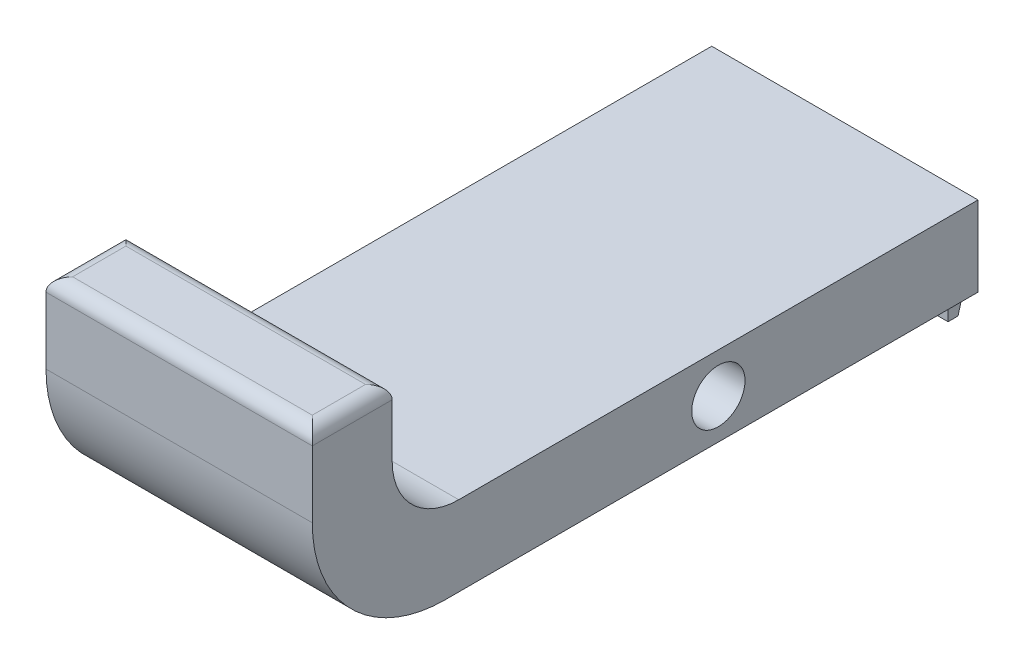
from build123d import *

# Parameters (mm, degrees)
SKETCH2_W                = 20
SKETCH2_H                = 6
BOSS_EXTRUDE1_DEPTH      = 50
BOSS_EXTRUDE3_DEPTH      = 9
BOSS_EXTRUDE3_DEPTH_BACK = 9
SKETCH6_R                = 2
CUT_EXTRUDE1_DEPTH       = 20
SKETCH7_W                = 20
SKETCH7_H                = 6
BOSS_EXTRUDE4_DEPTH      = 10
FILLET1_R                = 10
FILLET2_R                = 5
FILLET3_R                = 1


with BuildPart() as part:
    # Sketch2 → Boss-Extrude1 (new body)
    with BuildSketch(Plane.XY):
        Rectangle(SKETCH2_W, SKETCH2_H)
    extrude(amount=BOSS_EXTRUDE1_DEPTH)

    # Sketch5 → Boss-Extrude3 (add, two sides: drawn at the far end of the back side and taken through both)
    with BuildSketch(Plane(origin=(0, 0, 0), x_dir=(0, 0, -1), z_dir=(1, 0, 0)).offset(-BOSS_EXTRUDE3_DEPTH_BACK)):
        Polygon((0, -3), (-0.5, -4.8), (-1.25, -4.8), (-1.25, -3), align=None)
    extrude(amount=BOSS_EXTRUDE3_DEPTH + BOSS_EXTRUDE3_DEPTH_BACK)

    # Sketch6 → Cut-Extrude1 (cut)
    with BuildSketch(Plane(origin=(10, 0, 0), x_dir=(0, 0, -1), z_dir=(1, 0, 0))):
        with Locations((-19.5, 0)):
            Circle(SKETCH6_R)
    extrude(amount=-CUT_EXTRUDE1_DEPTH, mode=Mode.SUBTRACT)

    # Sketch7 → Boss-Extrude4 (add)
    with BuildSketch(Plane(origin=(0, 3, 0), x_dir=(1, 0, 0), z_dir=(0, 1, 0))):
        with Locations((0, -47)):
            Rectangle(SKETCH7_W, SKETCH7_H)
    extrude(amount=BOSS_EXTRUDE4_DEPTH)

    # Fillet1
    fillet1_edges = [part.edges().sort_by_distance(p)[0] for p in [
        (0, -3, 50),
    ]]
    fillet(fillet1_edges, radius=FILLET1_R)

    # Fillet2
    fillet2_edges = [part.edges().sort_by_distance(p)[0] for p in [
        (0, 3, 44),
    ]]
    fillet(fillet2_edges, radius=FILLET2_R)

    # Fillet3
    fillet3_edges = [part.edges().sort_by_distance(p)[0] for p in [
        (-10, 13, 47),
        (0, 13, 50),
        (10, 13, 47),
        (0, 13, 44),
    ]]
    fillet(fillet3_edges, radius=FILLET3_R)


solid = part.part
